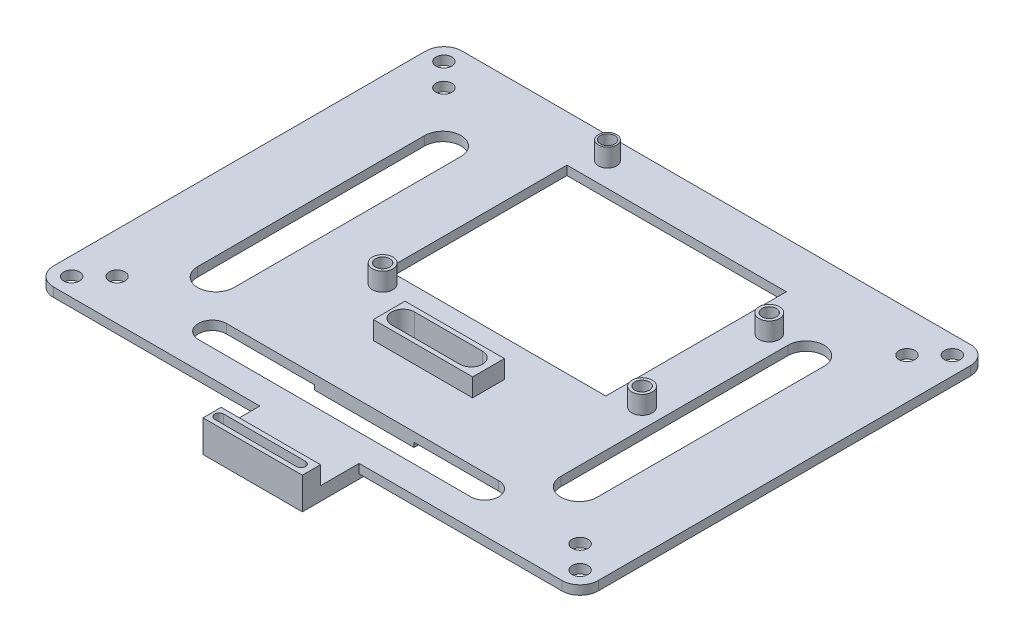
from build123d import *

# Parameters (mm, degrees)
SKETCH1_W               = 120
SKETCH1_H               = 90
BOSS_EXTRUDE1_DEPTH     = 2
FILLET1_R               = 4
SKETCH3_R               = 2.25
BOSS_EXTRUDE2_DEPTH     = 4
SKETCH3_R_2             = 2
BOSS_EXTRUDE2_2_DEPTH   = 4
BOSS_EXTRUDE2_3_DEPTH   = 4
SKETCH4_R               = 1.6
CUT_EXTRUDE2_DEPTH      = 10
SKETCH7_W               = 43.376997866
SKETCH7_H               = 21.38114218
CUT_EXTRUDE3_DEPTH      = 10
SKETCH9_R               = 2.25
BOSS_EXTRUDE3_DEPTH     = 4
SKETCH10_R              = 1.6
CUT_EXTRUDE4_DEPTH      = 8
SKETCH11_W              = 21.884088293
SKETCH11_H              = 7
BOSS_EXTRUDE4_DEPTH     = 4
SKETCH12_W              = 21.884088293
SKETCH12_H              = 44.5
BOSS_EXTRUDE5_DEPTH     = 3
SKETCH13_W              = 21.884088293
SKETCH13_H              = 4
BOSS_EXTRUDE6_DEPTH     = 4
CUT_EXTRUDE5_DEPTH      = 11
CUT_EXTRUDE6_DEPTH      = 11
SKETCH17_R              = 1.75
CUT_EXTRUDE7_DEPTH      = 3
SKETCH18_R              = 1.75
CUT_EXTRUDE8_DEPTH      = 10
MIRROR2_COPY_1_SKETCH_R = 1.75
MIRROR2_COPY_1_DEPTH    = 10
CUT_EXTRUDE9_DEPTH      = 10
CUT_EXTRUDE10_DEPTH     = 10
SKETCH21_W              = 48.328287205
SKETCH21_H              = 39.767929333
CUT_EXTRUDE11_DEPTH     = 10


with BuildPart() as part:
    # Sketch1 → Boss-Extrude1 (new body)
    with BuildSketch(Plane(origin=(0, 0, 0), x_dir=(1, 0, 0), z_dir=(0, 1, 0))):
        Rectangle(SKETCH1_W, SKETCH1_H)
    extrude(amount=BOSS_EXTRUDE1_DEPTH)

    # Fillet1
    fillet1_edges = [part.edges().sort_by_distance(p)[0] for p in [
        (-60, 1, 45),
        (-60, 1, -45),
        (60, 1, -45),
        (60, 1, 45),
    ]]
    fillet(fillet1_edges, radius=FILLET1_R)


with BuildPart() as body_2:
    # Sketch3 → Boss-Extrude2 (new body)
    with BuildSketch(Plane(origin=(0, 2, 0), x_dir=(1, 0, 0), z_dir=(0, 1, 0))):
        with Locations(Location((31.74, -3.08, 0), (0, 0, 270))):
            Circle(SKETCH3_R)
    extrude(amount=BOSS_EXTRUDE2_DEPTH)


with BuildPart() as body_3:
    # Sketch3 → Boss-Extrude2 2 (new body)
    with BuildSketch(Plane(origin=(0, 2, 0), x_dir=(1, 0, 0), z_dir=(0, 1, 0))):
        with Locations(Location((-19.06, 40.1, 0), (0, 0, 270))):
            Circle(SKETCH3_R_2)
    extrude(amount=BOSS_EXTRUDE2_2_DEPTH)


with BuildPart() as body_4:
    # Sketch3 → Boss-Extrude2 3 (new body)
    with BuildSketch(Plane(origin=(0, 2, 0), x_dir=(1, 0, 0), z_dir=(0, 1, 0))):
        with Locations(Location((31.74, 24.92, 0), (0, 0, 270))):
            Circle(SKETCH3_R)
    extrude(amount=BOSS_EXTRUDE2_3_DEPTH)


with BuildPart() as cut_extrude2_tool:
    # Sketch4 → Cut-Extrude2 (new body)
    with BuildSketch(Plane(origin=(0, 6, 0), x_dir=(1, 0, 0), z_dir=(0, 1, 0))):
        with Locations(Location((-19.06, 40.1, 0), (0, 0, 270))):
            Circle(SKETCH4_R)
        with Locations(Location((31.74, 24.92, 0), (0, 0, 270))):
            Circle(SKETCH4_R)
        with Locations(Location((31.74, -3.08, 0), (0, 0, 270))):
            Circle(SKETCH4_R)
    extrude(amount=-CUT_EXTRUDE2_DEPTH)


with BuildPart() as part_1:
    add(part.part)

    # Cut-Extrude2: cut by cut_extrude2_tool
    add(cut_extrude2_tool.part, mode=Mode.SUBTRACT)

    # Sketch7 → Cut-Extrude3 (cut)
    with BuildSketch(Plane(origin=(0, 2, 0), x_dir=(1, 0, 0), z_dir=(0, 1, 0))):
        with Locations((-1, 15)):
            Rectangle(SKETCH7_W, SKETCH7_H)
    extrude(amount=-CUT_EXTRUDE3_DEPTH, mode=Mode.SUBTRACT)

    # Sketch9 → Boss-Extrude3 (add)
    with BuildSketch(Plane(origin=(0, 2, 0), x_dir=(1, 0, 0), z_dir=(0, 1, 0))):
        with Locations(Location((-20.33, -8.16, 0), (0, 0, 270))):
            Circle(SKETCH9_R)
    extrude(amount=BOSS_EXTRUDE3_DEPTH)

    # Sketch10 → Cut-Extrude4 (cut)
    with BuildSketch(Plane(origin=(0, 6, 0), x_dir=(1, 0, 0), z_dir=(0, 1, 0))):
        with Locations(Location((-20.33, -8.16, 0), (0, 0, 270))):
            Circle(SKETCH10_R)
    extrude(amount=-CUT_EXTRUDE4_DEPTH, mode=Mode.SUBTRACT)

    # Sketch11 → Boss-Extrude4 (add)
    with BuildSketch(Plane(origin=(0, 2, 0), x_dir=(1, 0, 0), z_dir=(0, 1, 0))):
        with Locations((0.383931373, -16.5)):
            Rectangle(SKETCH11_W, SKETCH11_H)
    extrude(amount=BOSS_EXTRUDE4_DEPTH)

    # Sketch12 → Boss-Extrude5 (add)
    with BuildSketch(Plane(origin=(0, 2, 0), x_dir=(1, 0, 0), z_dir=(0, 1, 0))):
        with Locations((0.383931373, -35.25)):
            Rectangle(SKETCH12_W, SKETCH12_H)
    extrude(amount=-BOSS_EXTRUDE5_DEPTH)

    # Sketch13 → Boss-Extrude6 (add)
    with BuildSketch(Plane(origin=(0, 2, 0), x_dir=(1, 0, 0), z_dir=(0, 1, 0))):
        with Locations((0.383931373, -55.5)):
            Rectangle(SKETCH13_W, SKETCH13_H)
    extrude(amount=BOSS_EXTRUDE6_DEPTH)

    # Sketch14 → Cut-Extrude5 (cut)
    with BuildSketch(Plane(origin=(0, 6, 0), x_dir=(1, 0, 0), z_dir=(0, 1, 0))):
        with BuildLine():
            Line((-7.5, -14), (7.5, -14))
            ThreePointArc((7.5, -14), (10, -16.5), (7.5, -19))
            Line((7.5, -19), (-7.5, -19))
            ThreePointArc((-7.5, -19), (-10, -16.5), (-7.5, -14))
        make_face()
    extrude(amount=-CUT_EXTRUDE5_DEPTH, mode=Mode.SUBTRACT)

    # Sketch15 → Cut-Extrude6 (cut)
    with BuildSketch(Plane(origin=(0, 6, 0), x_dir=(1, 0, 0), z_dir=(0, 1, 0))):
        with BuildLine():
            Line((-9, -54.5), (9, -54.5))
            ThreePointArc((9, -54.5), (10, -55.5), (9, -56.5))
            Line((9, -56.5), (-9, -56.5))
            ThreePointArc((-9, -56.5), (-10, -55.5), (-9, -54.5))
        make_face()
    extrude(amount=-CUT_EXTRUDE6_DEPTH, mode=Mode.SUBTRACT)

    # Sketch17 → Cut-Extrude7 (cut)
    with BuildSketch(Plane(origin=(0, 2, 0), x_dir=(1, 0, 0), z_dir=(0, 1, 0))):
        with Locations(Location((-51, 36, 0), (0, 0, 270))):
            Circle(SKETCH17_R)
        with Locations(Location((51, 36, 0), (0, 0, 270))):
            Circle(SKETCH17_R)
        with Locations(Location((51, -36, 0), (0, 0, 270))):
            Circle(SKETCH17_R)
        with Locations(Location((-51, -36, 0), (0, 0, 270))):
            Circle(SKETCH17_R)
    extrude(amount=-CUT_EXTRUDE7_DEPTH, mode=Mode.SUBTRACT)

    # Sketch18 → Cut-Extrude8 (cut)
    with BuildSketch(Plane(origin=(0, 2, 0), x_dir=(1, 0, 0), z_dir=(0, 1, 0))):
        with Locations(Location((-56, 41, 0), (0, 0, 270))):
            Circle(SKETCH18_R)
    cut_extrude8 = extrude(amount=-CUT_EXTRUDE8_DEPTH, mode=Mode.SUBTRACT)

    # Mirror1: Cut-Extrude8 across plane
    add(cut_extrude8.mirror(Plane(origin=(0, 0, 0), x_dir=(0, 0, 1), z_dir=(1, 0, 0))), mode=Mode.SUBTRACT)

    # Mirror2: Cut-Extrude8 across plane
    add(cut_extrude8.mirror(Plane.XY), mode=Mode.SUBTRACT)

    # Mirror2 copy 1 sketch → Mirror2 copy 1 (cut)
    with BuildSketch(Plane(origin=(0, 2, 0), x_dir=(-1, 0, 0), z_dir=(0, 1, 0))):
        with Locations(Location((-56, 41, 0), (0, 0, 270))):
            Circle(MIRROR2_COPY_1_SKETCH_R)
    extrude(amount=-MIRROR2_COPY_1_DEPTH, mode=Mode.SUBTRACT)

    # Sketch19 → Cut-Extrude9 (cut)
    with BuildSketch(Plane(origin=(0, 2, 0), x_dir=(1, 0, 0), z_dir=(0, 1, 0))):
        with BuildLine():
            Line((-44, -25.233051022), (-44, 24.766948978))
            ThreePointArc((-44, 24.766948978), (-40, 28.766948978), (-36, 24.766948978))
            Line((-36, 24.766948978), (-36, -25.233051022))
            ThreePointArc((-36, -25.233051022), (-40, -29.233051022), (-44, -25.233051022))
        make_face()
    cut_extrude9 = extrude(amount=-CUT_EXTRUDE9_DEPTH, mode=Mode.SUBTRACT)

    # Mirror3: Cut-Extrude9 across plane
    add(cut_extrude9.mirror(Plane(origin=(0, 0, 0), x_dir=(0, 0, 1), z_dir=(1, 0, 0))), mode=Mode.SUBTRACT)

    # Sketch20 → Cut-Extrude10 (cut)
    with BuildSketch(Plane(origin=(0, 2, 0), x_dir=(1, 0, 0), z_dir=(0, 1, 0))):
        with BuildLine():
            Line((-30, -32.924941093), (30, -32.924941093))
            ThreePointArc((30, -32.924941093), (33.075058907, -36), (30, -39.075058907))
            Line((30, -39.075058907), (-30, -39.075058907))
            ThreePointArc((-30, -39.075058907), (-33.075058907, -36), (-30, -32.924941093))
        make_face()
    extrude(amount=-CUT_EXTRUDE10_DEPTH, mode=Mode.SUBTRACT)

    # Sketch21 → Cut-Extrude11 (cut)
    with BuildSketch(Plane(origin=(0, 2, 0), x_dir=(1, 0, 0), z_dir=(0, 1, 0))):
        with Locations((1.475644669, 14.904510513)):
            Rectangle(SKETCH21_W, SKETCH21_H)
    extrude(amount=-CUT_EXTRUDE11_DEPTH, mode=Mode.SUBTRACT)


with BuildPart() as body_2_1:
    add(body_2.part)

    # Cut-Extrude2: cut by cut_extrude2_tool
    add(cut_extrude2_tool.part, mode=Mode.SUBTRACT)


with BuildPart() as body_3_1:
    add(body_3.part)

    # Cut-Extrude2: cut by cut_extrude2_tool
    add(cut_extrude2_tool.part, mode=Mode.SUBTRACT)


with BuildPart() as body_4_1:
    add(body_4.part)

    # Cut-Extrude2: cut by cut_extrude2_tool
    add(cut_extrude2_tool.part, mode=Mode.SUBTRACT)


solid = Compound([part_1.part, body_2_1.part, body_3_1.part, body_4_1.part])
